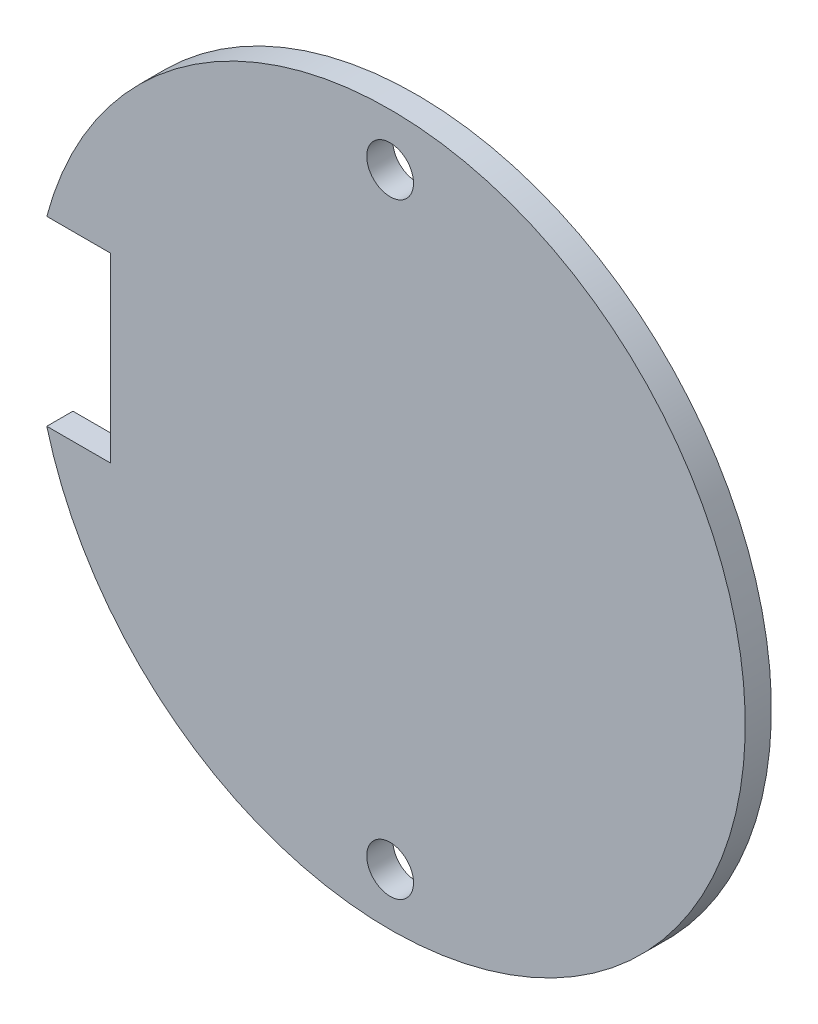
from build123d import *

# Parameters (mm, degrees)
SKETCH1_R           = 1.4224
BOSS_EXTRUDE1_DEPTH = 1.5875


with BuildPart() as part:
    # Sketch1 → Boss-Extrude1 (new body)
    with BuildSketch(Plane.XY):
        with BuildLine():
            Line((-20.871224203, 5.5245), (-16.984058744, 5.5245))
            Line((-16.984058744, 5.5245), (-16.984058744, -5.5245))
            Line((-16.984058744, -5.5245), (-20.871224203, -5.5245))
            ThreePointArc((-20.871224203, -5.5245), (21.59, 0), (-20.871224203, 5.5245))
        make_face()
        with Locations((0, 18.415)):
            Circle(SKETCH1_R, mode=Mode.SUBTRACT)
        with Locations((0, -18.415)):
            Circle(SKETCH1_R, mode=Mode.SUBTRACT)
    extrude(amount=BOSS_EXTRUDE1_DEPTH)


solid = part.part
